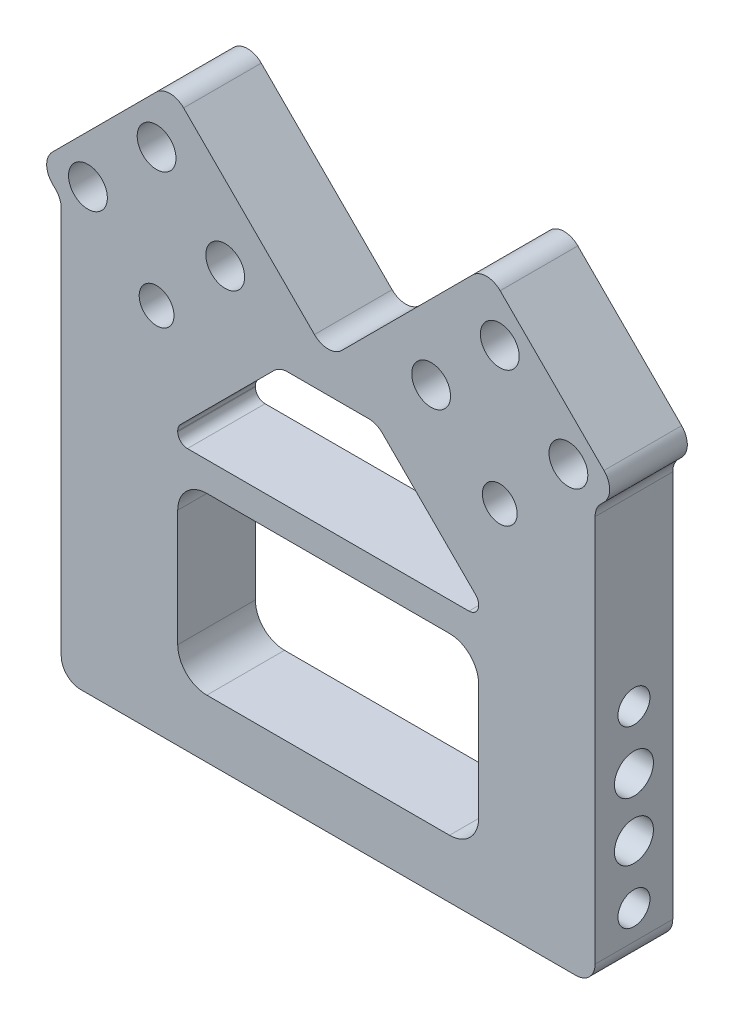
from build123d import *
from OCP.BRepFilletAPI import BRepFilletAPI_MakeFillet

# Parameters (mm, degrees)
SKETCH_1_W          = 55
SKETCH_1_H          = 48
EXTRUDE_1_DEPTH     = 8
SKETCH_2_R          = 1.65
SKETCH_2_R_2        = 2.01
CUT_EXTRUDE_1_DEPTH = 10
SKETCH_4_W          = 5
SKETCH_4_H          = 18
EXTRUDE_2_DEPTH     = 8
CUT_EXTRUDE_2_DEPTH = 8
SKETCH_5_R          = 1.25
CUT_EXTRUDE_3_DEPTH = 8
SKETCH_6_W          = 31
SKETCH_6_H          = 18
CUT_EXTRUDE_4_DEPTH = 8
FILLET_1_R1         = 2
FILLET_1_R2         = 3
FILLET_1_R3         = 5
SKETCH_7_R          = 1.25
EXTRUDE_3_DEPTH     = 8
EXTRUDE_START       = -8
EXTRUDE_4_DEPTH     = 8
CUT_EXTRUDE_START   = -10
CUT_EXTRUDE_6_DEPTH = 10
CUT_EXTRUDE_7_DEPTH = 10
FILLET_4_R          = 2
FILLET_5_R          = 2
FILLET_6_R          = 2
FILLET_7_R          = 1
FILLET_8_R          = 2
SKETCH_13_R         = 2
SKETCH_13_R_2       = 1.793563064
CUT_EXTRUDE_8_DEPTH = 10


with BuildPart() as part:
    # 草图1 → 凸台-拉伸1 (new body)
    with BuildSketch(Plane.XY):
        Rectangle(SKETCH_1_W, SKETCH_1_H)
    extrude(amount=EXTRUDE_1_DEPTH)

    # 草图2 → 切除-拉伸1 (cut)
    with BuildSketch(Plane.ZY.offset(27.5)):
        with Locations((4, -19)):
            Circle(SKETCH_2_R)
        with Locations((4, -1)):
            Circle(SKETCH_2_R)
        with Locations((4, -13)):
            Circle(SKETCH_2_R_2)
        with Locations((4, -7)):
            Circle(SKETCH_2_R_2)
    cut_extrude_1 = extrude(amount=-CUT_EXTRUDE_1_DEPTH, mode=Mode.SUBTRACT)

    # 镜向1: 切除-拉伸1 across plane
    add(cut_extrude_1.mirror(Plane(origin=(0, 0, 0), x_dir=(0, 0, 1), z_dir=(1, 0, 0))), mode=Mode.SUBTRACT)

    # 草图4 → 凸台-拉伸2 (add)
    with BuildSketch(Plane.XY.offset(8)):
        with Locations((30, 15)):
            Rectangle(SKETCH_4_W, SKETCH_4_H)
        with Locations((-30, 15)):
            Rectangle(SKETCH_4_W, SKETCH_4_H)
    extrude(amount=-EXTRUDE_2_DEPTH)

    # 草图3 → 切除-拉伸2 (cut)
    with BuildSketch(Plane.XY.offset(8)):
        Polygon((-32.5, 11.340620434), (-19.840620434, 24), (-32.5, 24), align=None)
        Polygon((32.5, 24), (19.840620434, 24), (32.5, 11.340620434), align=None)
    extrude(amount=-CUT_EXTRUDE_2_DEPTH, mode=Mode.SUBTRACT)

    # 草图5 → 切除-拉伸3 (cut)
    with BuildSketch(Plane.XY.offset(8)):
        with Locations((19.084414101, 19.071067812)):
            Circle(SKETCH_5_R)
        with Locations((26.155481913, 12)):
            Circle(SKETCH_5_R)
        with Locations((19.084414101, 4.928932188)):
            Circle(SKETCH_5_R)
        with Locations((12.013346289, 12)):
            Circle(SKETCH_5_R)
        with Locations(Location((-12.013346289, 12, 0), (0, 0, 180))):
            Circle(SKETCH_5_R)
        with Locations(Location((-19.084414101, 4.928932188, 0), (0, 0, 180))):
            Circle(SKETCH_5_R)
        with Locations(Location((-26.155481913, 12, 0), (0, 0, 180))):
            Circle(SKETCH_5_R)
        with Locations(Location((-19.084414101, 19.071067812, 0), (0, 0, 180))):
            Circle(SKETCH_5_R)
        Polygon((14.841773414, 12), (19.084414101, 16.242640687), (23.327054788, 12), (19.084414101, 7.757359313), align=None)
        Polygon((-19.084414101, 16.242640687), (-23.327054788, 12), (-19.084414101, 7.757359313), (-14.841773414, 12), align=None)
    extrude(amount=-CUT_EXTRUDE_3_DEPTH, mode=Mode.SUBTRACT)

    # 草图6 → 切除-拉伸4 (cut)
    with BuildSketch(Plane.XY.offset(8)):
        with Locations((0, -9)):
            Rectangle(SKETCH_6_W, SKETCH_6_H)
        Polygon((-19.840620434, 24), (0, 4.159379566), (19.840620434, 24), align=None)
        Polygon((32.5, 11.340620434), (27.5, 6), (32.5, 6), align=None)
        Polygon((-32.5, 11.340620434), (-32.5, 6), (-27.5, 6), align=None)
    extrude(amount=-CUT_EXTRUDE_4_DEPTH, mode=Mode.SUBTRACT)

    # 圆角1: one fillet with a radius per group of edges: ONE call of the kernel's fillet builder (fillet() takes one radius for all edges)
    fillet_1_edges_1 = [part.edges().sort_by_distance(p)[0] for p in [
        (-27.5, -24, 4),
        (27.5, -24, 4),
        (-19.084414101, 16.242640687, 4),
        (-14.841773414, 12, 4),
        (-23.327054788, 12, 4),
        (-19.084414101, 7.757359313, 4),
        (14.841773414, 12, 4),
        (19.084414101, 7.757359313, 4),
        (23.327054788, 12, 4),
        (19.084414101, 16.242640687, 4),
    ]]
    fillet_1_edges_2 = [part.edges().sort_by_distance(p)[0] for p in [
        (32.5, 11.340620434, 4),
        (19.840620434, 24, 4),
        (-19.840620434, 24, 4),
        (-32.5, 11.340620434, 4),
        (-27.5, 6, 4),
        (27.5, 6, 4),
        (15.5, 0, 4),
        (-15.5, 0, 4),
        (-15.5, -18, 4),
        (15.5, -18, 4),
    ]]
    fillet_1_edges_3 = [part.edges().sort_by_distance(p)[0] for p in [
        (0, 4.159379566, 4),
    ]]
    fillet_1 = BRepFilletAPI_MakeFillet(part.part.solid().wrapped)
    for e in fillet_1_edges_1:
        fillet_1.Add(FILLET_1_R1, e.wrapped)
    for e in fillet_1_edges_2:
        fillet_1.Add(FILLET_1_R2, e.wrapped)
    for e in fillet_1_edges_3:
        fillet_1.Add(FILLET_1_R3, e.wrapped)
    add(Compound.cast(fillet_1.Shape()), mode=Mode.REPLACE)

    # 草图7 → 凸台-拉伸3 (add)
    with BuildSketch(Plane.XY.offset(8)):
        with Locations((19.084414101, 19.071067812)):
            Circle(SKETCH_7_R)
        with Locations((-26.155481913, 12)):
            Circle(SKETCH_7_R)
        with Locations((-19.084414101, 4.928932188)):
            Circle(SKETCH_7_R)
        with Locations((-19.084414101, 19.071067812)):
            Circle(SKETCH_7_R)
        with Locations((-12.013346289, 12)):
            Circle(SKETCH_7_R)
        with Locations((12.013346289, 12)):
            Circle(SKETCH_7_R)
        with Locations((19.084414101, 4.928932188)):
            Circle(SKETCH_7_R)
        with Locations((26.155481913, 12)):
            Circle(SKETCH_7_R)
        with BuildLine():
            Line((-16.255986976, 13.414213562), (-17.670200539, 14.828427125))
            ThreePointArc((-17.670200539, 14.828427125), (-19.084414101, 15.414213562), (-20.498627663, 14.828427125))
            Line((-20.498627663, 14.828427125), (-21.912841226, 13.414213562))
            ThreePointArc((-21.912841226, 13.414213562), (-22.498627663, 12), (-21.912841226, 10.585786438))
            Line((-21.912841226, 10.585786438), (-20.498627663, 9.171572875))
            ThreePointArc((-20.498627663, 9.171572875), (-19.084414101, 8.585786438), (-17.670200539, 9.171572875))
            Line((-17.670200539, 9.171572875), (-16.255986976, 10.585786438))
            ThreePointArc((-16.255986976, 10.585786438), (-15.670200539, 12), (-16.255986976, 13.414213562))
        make_face()
        with BuildLine():
            Line((16.255986976, 10.585786438), (17.670200539, 9.171572875))
            ThreePointArc((17.670200539, 9.171572875), (19.084414101, 8.585786438), (20.498627663, 9.171572875))
            Line((20.498627663, 9.171572875), (21.912841226, 10.585786438))
            ThreePointArc((21.912841226, 10.585786438), (22.498627663, 12), (21.912841226, 13.414213562))
            Line((21.912841226, 13.414213562), (20.498627663, 14.828427125))
            ThreePointArc((20.498627663, 14.828427125), (19.084414101, 15.414213562), (17.670200539, 14.828427125))
            Line((17.670200539, 14.828427125), (16.255986976, 13.414213562))
            ThreePointArc((16.255986976, 13.414213562), (15.670200539, 12), (16.255986976, 10.585786438))
        make_face()
    extrude(amount=-EXTRUDE_3_DEPTH)

    # 草图9 → 凸台-拉伸4 (add)
    with BuildSketch(Plane.XY.offset(8).offset(EXTRUDE_START)):
        with BuildLine():
            ThreePointArc((30.447405477, 13.393214957), (31.325678544, 11.32128458), (30.516094042, 9.221562694))
            Line((30.516094042, 9.221562694), (36.103109797, 14.808578449))
            Line((36.103109797, 14.808578449), (16.305086528, 34.606601718))
            Line((16.305086528, 34.606601718), (0, 18.30151519))
            Line((0, 18.30151519), (0, 6.230447378))
            ThreePointArc((0, 6.230447378), (1.913417162, 6.611049716), (3.535533906, 7.694913472))
            Line((3.535533906, 7.694913472), (17.71930009, 21.878679656))
            ThreePointArc((17.71930009, 21.878679656), (19.840620434, 22.757359313), (21.961940777, 21.878679656))
            Line((21.961940777, 21.878679656), (30.447405477, 13.393214957))
        make_face()
        with BuildLine():
            Line((0, 6.230447378), (0, 18.30151519))
            Line((0, 18.30151519), (-16.305086528, 34.606601718))
            Line((-16.305086528, 34.606601718), (-36.103109797, 14.808578449))
            Line((-36.103109797, 14.808578449), (-30.516094042, 9.221562694))
            ThreePointArc((-30.516094042, 9.221562694), (-31.325678544, 11.32128458), (-30.447405477, 13.393214957))
            Line((-30.447405477, 13.393214957), (-21.961940777, 21.878679656))
            ThreePointArc((-21.961940777, 21.878679656), (-19.840620434, 22.757359313), (-17.71930009, 21.878679656))
            Line((-17.71930009, 21.878679656), (-3.535533906, 7.694913472))
            ThreePointArc((-3.535533906, 7.694913472), (-1.913417162, 6.611049716), (0, 6.230447378))
        make_face()
    extrude(amount=EXTRUDE_4_DEPTH)

    # 草图10 → 切除-拉伸6 (cut)
    with BuildSketch(Plane.XY.offset(8).offset(CUT_EXTRUDE_START)):
        with BuildLine():
            Line((27.5, 18.756314603), (27.5, 4.814839075))
            ThreePointArc((27.5, 4.814839075), (27.70983632, 5.917103398), (28.309991091, 6.865170995))
            Line((28.309991091, 6.865170995), (30.516094042, 9.221562694))
            Line((30.516094042, 9.221562694), (36.103109797, 14.808578449))
            Line((36.103109797, 14.808578449), (29.827686821, 21.084001424))
            Line((29.827686821, 21.084001424), (27.5, 18.756314603))
        make_face()
        with BuildLine():
            ThreePointArc((-28.309991091, 6.865170995), (-27.70983632, 5.917103398), (-27.5, 4.814839075))
            Line((-27.5, 4.814839075), (-27.5, 18.756314603))
            Line((-27.5, 18.756314603), (-29.827686821, 21.084001424))
            Line((-29.827686821, 21.084001424), (-36.103109797, 14.808578449))
            Line((-36.103109797, 14.808578449), (-30.516094042, 9.221562694))
            Line((-30.516094042, 9.221562694), (-28.309991091, 6.865170995))
        make_face()
    extrude(amount=CUT_EXTRUDE_6_DEPTH, mode=Mode.SUBTRACT)

    # 草图11 → 切除-拉伸7 (cut)
    with BuildSketch(Plane.XY.offset(8)):
        Polygon((-5, 15), (-15.5, 4.5), (-15.5, 3), (15.5, 3), (15.5, 4.5), (5, 15), align=None)
    extrude(amount=-CUT_EXTRUDE_7_DEPTH, mode=Mode.SUBTRACT)

    # 圆角4
    fillet_4_edges = [part.edges().sort_by_distance(p)[0] for p in [
        (-27.5, 18.756314603, 4),
    ]]
    fillet(fillet_4_edges, radius=FILLET_4_R)

    # 圆角5
    fillet_5_edges = [part.edges().sort_by_distance(p)[0] for p in [
        (-16.305086528, 34.606601718, 4),
        (16.305086528, 34.606601718, 4),
        (0, 18.30151519, 4),
        (29.827686821, 21.084001424, 4),
        (-29.827686821, 21.084001424, 4),
    ]]
    fillet(fillet_5_edges, radius=FILLET_5_R)

    # 圆角6
    fillet_6_edges = [part.edges().sort_by_distance(p)[0] for p in [
        (27.5, 18.756314603, 4),
    ]]
    fillet(fillet_6_edges, radius=FILLET_6_R)

    # 圆角7
    fillet_7_edges = [part.edges().sort_by_distance(p)[0] for p in [
        (15.5, 4.5, 4),
        (15.5, 3, 4),
        (-15.5, 3, 4),
        (-15.5, 4.5, 4),
    ]]
    fillet(fillet_7_edges, radius=FILLET_7_R)

    # 圆角8
    fillet_8_edges = [part.edges().sort_by_distance(p)[0] for p in [
        (-5, 15, 4),
        (5, 15, 4),
    ]]
    fillet(fillet_8_edges, radius=FILLET_8_R)

    # 草图13 → 切除-拉伸8 (cut)
    with BuildSketch(Plane.XY.offset(8)):
        with Locations((17.67766953, 28.302433917)):
            Circle(SKETCH_13_R)
        with Locations((24.748737342, 21.231366105)):
            Circle(SKETCH_13_R)
        with Locations((17.67766953, 14.160298293)):
            Circle(SKETCH_13_R_2)
        with Locations((10.606601718, 21.231366105)):
            Circle(SKETCH_13_R)
        with Locations((-10.606601718, 21.231366105)):
            Circle(SKETCH_13_R)
        with Locations((-17.67766953, 14.160298293)):
            Circle(SKETCH_13_R_2)
        with Locations((-24.748737342, 21.231366105)):
            Circle(SKETCH_13_R)
        with Locations((-17.67766953, 28.302433917)):
            Circle(SKETCH_13_R)
    extrude(amount=-CUT_EXTRUDE_8_DEPTH, mode=Mode.SUBTRACT)


solid = part.part
